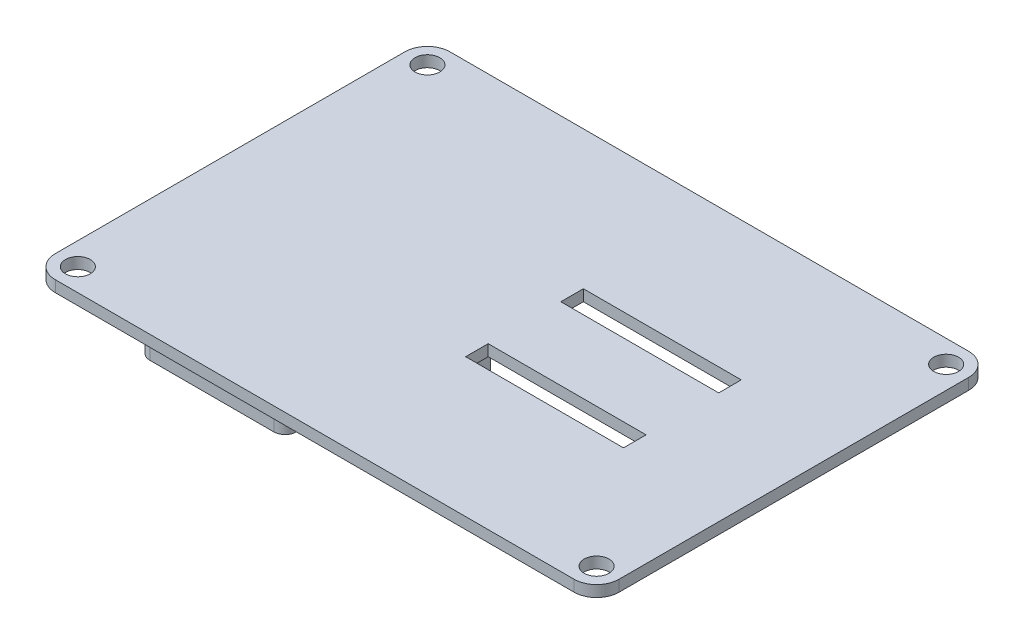
from build123d import *

# Parameters (mm, degrees)
SKETCH1_W                    = 127
SKETCH1_H                    = 88.9
BOSS_EXTRUDE2_DEPTH          = 2.54
SKETCH2_R                    = 2.794
CUT_EXTRUDE1_DEPTH           = 5.08
SKETCH9_W                    = 35.56
SKETCH9_H                    = 5.08
CUT_EXTRUDE5_DEPTH           = 6.35
SKETCH8_W                    = 33.02
SKETCH8_H                    = 53.34
BOSS_EXTRUDE4_DEPTH          = 21.59
SHELL4_T                     = -2.54
SKETCH13_W                   = 24.612851837
SKETCH13_H                   = 14.097856124
CUT_EXTRUDE6_DEPTH           = 5.08
FILLET5_R                    = 2.54
FILLET6_R                    = 2.54
FILLET7_R                    = 2.54
FILLET8_R                    = 2.54
FILLET1_R                    = 5.08
FILLET2_R                    = 5.08
FILLET3_R                    = 5.08
FILLET4_R                    = 5.08
FILLET9_R                    = 2.54
FILLET10_R                   = 2.54
FILLET11_R                   = 2.54
FILLET12_R                   = 2.54
SKETCH17_R                   = 3.175
BOSS_EXTRUDE5_DEPTH          = 7.62
SKETCH18_R                   = 1.651
CUT_EXTRUDE7_DEPTH           = 5.08
CUT_EXTRUDE7_DRAFT           = -2
CUT_EXTRUDE7_PROFILE_2_DEPTH = 5.08
CUT_EXTRUDE7_PROFILE_2_DRAFT = -2
CUT_EXTRUDE7_PROFILE_3_DEPTH = 5.08
CUT_EXTRUDE7_PROFILE_3_DRAFT = -2
CUT_EXTRUDE7_PROFILE_4_DEPTH = 5.08
CUT_EXTRUDE7_PROFILE_4_DRAFT = -2


with BuildPart() as part:
    # Sketch1 → Boss-Extrude2 (new body)
    with BuildSketch(Plane(origin=(0, 0, 0), x_dir=(1, 0, 0), z_dir=(0, 1, 0))):
        Rectangle(SKETCH1_W, SKETCH1_H)
    extrude(amount=BOSS_EXTRUDE2_DEPTH)

    # Sketch2 → Cut-Extrude1 (cut)
    with BuildSketch(Plane(origin=(0, 0, 0), x_dir=(-1, 0, 0), z_dir=(0, -1, 0))):
        with Locations(Location((58.42, 39.37, 0), (0, 0, 90))):
            Circle(SKETCH2_R)
        with Locations(Location((58.42, -39.37, 0), (0, 0, 90))):
            Circle(SKETCH2_R)
        with Locations(Location((-58.42, -39.37, 0), (0, 0, 90))):
            Circle(SKETCH2_R)
        with Locations(Location((-58.42, 39.37, 0), (0, 0, 90))):
            Circle(SKETCH2_R)
    extrude(amount=-CUT_EXTRUDE1_DEPTH, mode=Mode.SUBTRACT)

    # Sketch9 → Cut-Extrude5 (cut)
    with BuildSketch(Plane(origin=(0, 0, 0), x_dir=(-1, 0, 0), z_dir=(0, -1, 0))):
        with Locations((-20.595526461, -10.719909337)):
            Rectangle(SKETCH9_W, SKETCH9_H)
        with Locations((-20.595526461, 10.719909337)):
            Rectangle(SKETCH9_W, SKETCH9_H)
    extrude(amount=-CUT_EXTRUDE5_DEPTH, mode=Mode.SUBTRACT)

    # Fillet1
    fillet1_edges = [part.edges().sort_by_distance(p)[0] for p in [
        (63.5, 1.27, 44.45),
    ]]
    fillet(fillet1_edges, radius=FILLET1_R)

    # Fillet2
    fillet2_edges = [part.edges().sort_by_distance(p)[0] for p in [
        (-63.5, 1.27, -44.45),
    ]]
    fillet(fillet2_edges, radius=FILLET2_R)

    # Fillet3
    fillet3_edges = [part.edges().sort_by_distance(p)[0] for p in [
        (-63.5, 1.27, 44.45),
    ]]
    fillet(fillet3_edges, radius=FILLET3_R)

    # Fillet4
    fillet4_edges = [part.edges().sort_by_distance(p)[0] for p in [
        (63.5, 1.27, -44.45),
    ]]
    fillet(fillet4_edges, radius=FILLET4_R)

    # Sketch17 → Boss-Extrude5 (add)
    with BuildSketch(Plane(origin=(0, 0, 0), x_dir=(-1, 0, 0), z_dir=(0, -1, 0))):
        with Locations(Location((1.025141255, -8.255, 0), (0, 0, 90))):
            Circle(SKETCH17_R)
        with Locations(Location((1.025141255, 37.465, 0), (0, 0, 90))):
            Circle(SKETCH17_R)
        with Locations(Location((-44.694858745, 37.465, 0), (0, 0, 90))):
            Circle(SKETCH17_R)
        with Locations(Location((-44.694858745, -8.255, 0), (0, 0, 90))):
            Circle(SKETCH17_R)
    extrude(amount=BOSS_EXTRUDE5_DEPTH)


with BuildPart() as body_2:
    # Sketch8 → Boss-Extrude4 (new body)
    with BuildSketch(Plane(origin=(0, 0, 0), x_dir=(-1, 0, 0), z_dir=(0, -1, 0))):
        with Locations((42.215940653, 1.27)):
            Rectangle(SKETCH8_W, SKETCH8_H)
    extrude(amount=BOSS_EXTRUDE4_DEPTH)

    # Shell4
    shell4_openings = [body_2.faces().sort_by_distance(p)[0] for p in [
        (-42.215940653, -21.59, -1.27),
    ]]
    offset(amount=SHELL4_T, openings=shell4_openings, kind=Kind.INTERSECTION)

    # Sketch13 → Cut-Extrude6 (cut)
    with BuildSketch(Plane(origin=(0, 0, -27.94), x_dir=(-1, 0, 0), z_dir=(0, 0, -1))):
        with Locations((42.215940653, -10.795)):
            Rectangle(SKETCH13_W, SKETCH13_H)
    extrude(amount=-CUT_EXTRUDE6_DEPTH, mode=Mode.SUBTRACT)

    # Fillet5
    fillet5_edges = [body_2.edges().sort_by_distance(p)[0] for p in [
        (-29.909514734, -17.843928062, -26.67),
    ]]
    fillet(fillet5_edges, radius=FILLET5_R)

    # Fillet6
    fillet6_edges = [body_2.edges().sort_by_distance(p)[0] for p in [
        (-29.909514734, -3.746071938, -26.67),
    ]]
    fillet(fillet6_edges, radius=FILLET6_R)

    # Fillet7
    fillet7_edges = [body_2.edges().sort_by_distance(p)[0] for p in [
        (-54.522366571, -3.746071938, -26.67),
    ]]
    fillet(fillet7_edges, radius=FILLET7_R)

    # Fillet8
    fillet8_edges = [body_2.edges().sort_by_distance(p)[0] for p in [
        (-54.522366571, -17.843928062, -26.67),
    ]]
    fillet(fillet8_edges, radius=FILLET8_R)

    # Fillet9
    fillet9_edges = [body_2.edges().sort_by_distance(p)[0] for p in [
        (-25.705940653, -10.795, -27.94),
    ]]
    fillet(fillet9_edges, radius=FILLET9_R)

    # Fillet10
    fillet10_edges = [body_2.edges().sort_by_distance(p)[0] for p in [
        (-25.705940653, -10.795, 25.4),
    ]]
    fillet(fillet10_edges, radius=FILLET10_R)

    # Fillet11
    fillet11_edges = [body_2.edges().sort_by_distance(p)[0] for p in [
        (-58.725940653, -10.795, 25.4),
    ]]
    fillet(fillet11_edges, radius=FILLET11_R)

    # Fillet12
    fillet12_edges = [body_2.edges().sort_by_distance(p)[0] for p in [
        (-58.725940653, -10.795, -27.94),
    ]]
    fillet(fillet12_edges, radius=FILLET12_R)


with BuildPart() as cut_extrude7_tool:
    # Sketch18 → Cut-Extrude7 (with draft: the straight prism first)
    with BuildSketch(Plane.XZ.offset(7.62)):
        with Locations((44.694858745, 8.255)):
            Circle(SKETCH18_R)
    extrude(amount=-CUT_EXTRUDE7_DEPTH)
    # Cut-Extrude7: the draft: its side faces are tilted about the plane it starts from
    cut_extrude7_sides = [cut_extrude7_tool.faces().sort_by_distance(p)[0] for p in [
        (43.043858745, -5.08, 8.255),
    ]]
    draft(cut_extrude7_sides, Plane.XZ.offset(7.62), CUT_EXTRUDE7_DRAFT)


with BuildPart() as part_1:
    add(part.part)

    # Cut-Extrude7: cut by cut_extrude7_tool
    add(cut_extrude7_tool.part, mode=Mode.SUBTRACT)


with BuildPart() as cut_extrude7_profile_2_tool:
    # Sketch18 → Cut-Extrude7 profile 2 (with draft: the straight prism first)
    with BuildSketch(Plane.XZ.offset(7.62)):
        with Locations((44.694858745, -37.465)):
            Circle(SKETCH18_R)
    extrude(amount=-CUT_EXTRUDE7_PROFILE_2_DEPTH)
    # Cut-Extrude7 profile 2: the draft: its side faces are tilted about the plane it starts from
    cut_extrude7_profile_2_sides = [cut_extrude7_profile_2_tool.faces().sort_by_distance(p)[0] for p in [
        (43.043858745, -5.08, -37.465),
    ]]
    draft(cut_extrude7_profile_2_sides, Plane.XZ.offset(7.62), CUT_EXTRUDE7_PROFILE_2_DRAFT)


with BuildPart() as part_2:
    add(part_1.part)

    # Cut-Extrude7 profile 2: cut by cut_extrude7_profile_2_tool
    add(cut_extrude7_profile_2_tool.part, mode=Mode.SUBTRACT)


with BuildPart() as cut_extrude7_profile_3_tool:
    # Sketch18 → Cut-Extrude7 profile 3 (with draft: the straight prism first)
    with BuildSketch(Plane.XZ.offset(7.62)):
        with Locations((-1.025141255, -37.465)):
            Circle(SKETCH18_R)
    extrude(amount=-CUT_EXTRUDE7_PROFILE_3_DEPTH)
    # Cut-Extrude7 profile 3: the draft: its side faces are tilted about the plane it starts from
    cut_extrude7_profile_3_sides = [cut_extrude7_profile_3_tool.faces().sort_by_distance(p)[0] for p in [
        (-2.676141255, -5.08, -37.465),
    ]]
    draft(cut_extrude7_profile_3_sides, Plane.XZ.offset(7.62), CUT_EXTRUDE7_PROFILE_3_DRAFT)


with BuildPart() as part_3:
    add(part_2.part)

    # Cut-Extrude7 profile 3: cut by cut_extrude7_profile_3_tool
    add(cut_extrude7_profile_3_tool.part, mode=Mode.SUBTRACT)


with BuildPart() as cut_extrude7_profile_4_tool:
    # Sketch18 → Cut-Extrude7 profile 4 (with draft: the straight prism first)
    with BuildSketch(Plane.XZ.offset(7.62)):
        with Locations((-1.025141255, 8.255)):
            Circle(SKETCH18_R)
    extrude(amount=-CUT_EXTRUDE7_PROFILE_4_DEPTH)
    # Cut-Extrude7 profile 4: the draft: its side faces are tilted about the plane it starts from
    cut_extrude7_profile_4_sides = [cut_extrude7_profile_4_tool.faces().sort_by_distance(p)[0] for p in [
        (-2.676141255, -5.08, 8.255),
    ]]
    draft(cut_extrude7_profile_4_sides, Plane.XZ.offset(7.62), CUT_EXTRUDE7_PROFILE_4_DRAFT)


with BuildPart() as part_4:
    add(part_3.part)

    # Cut-Extrude7 profile 4: cut by cut_extrude7_profile_4_tool
    add(cut_extrude7_profile_4_tool.part, mode=Mode.SUBTRACT)


solid = Compound([body_2.part, part_4.part])
